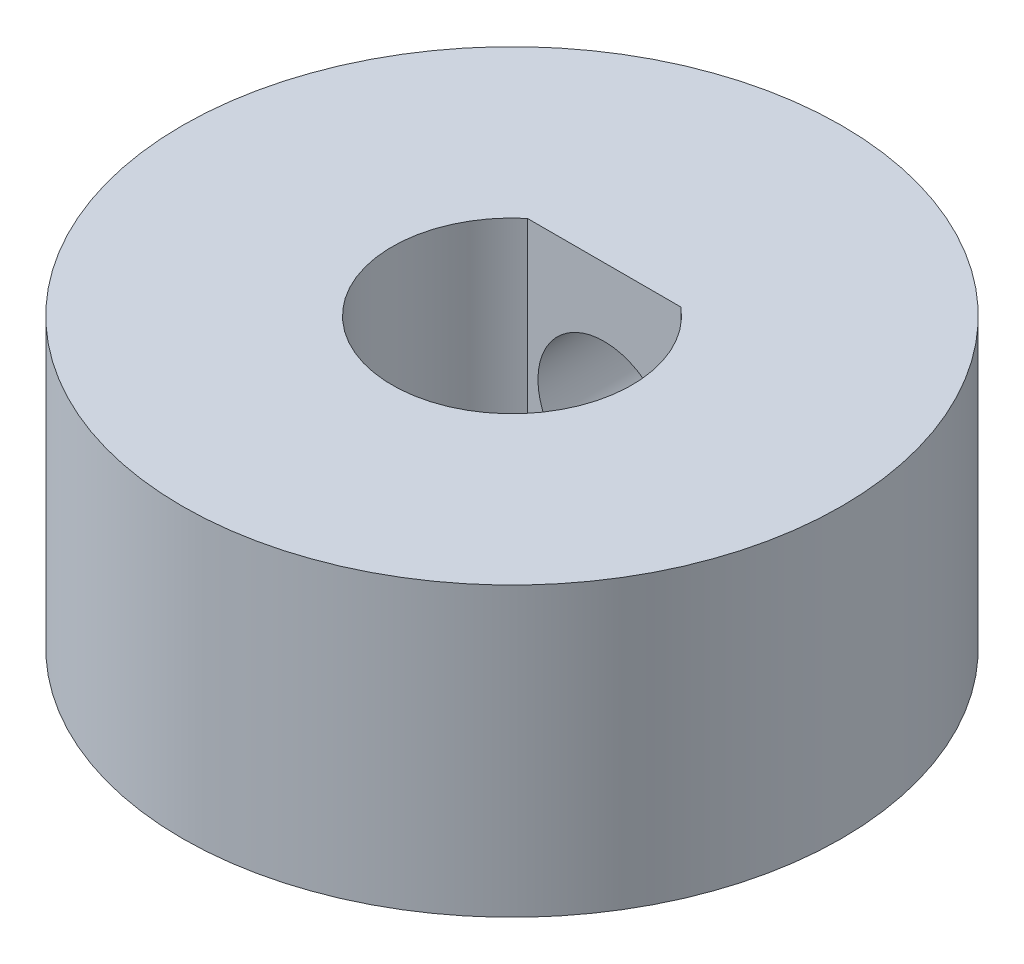
from build123d import *

# Parameters (mm, degrees)
SKETCH1_R           = 8.73125
BOSS_EXTRUDE1_DEPTH = 7.62
SKETCH2_R           = 2.7686
CUT_EXTRUDE1_DEPTH  = 3.81
CUT_EXTRUDE2_REACH  = 19.908
SKETCH3_R           = 1.7526


with BuildPart() as part:
    # Sketch1 → Boss-Extrude1 (new body)
    with BuildSketch(Plane(origin=(0, 0, 0), x_dir=(1, 0, 0), z_dir=(0, 1, 0))):
        with Locations(Location((0, 0, 0), (0, 0, 90))):
            Circle(SKETCH1_R)
        with BuildLine():
            Line((-2.032, 2.439590334), (2.032, 2.439590334))
            ThreePointArc((2.032, 2.439590334), (0, -3.175), (-2.032, 2.439590334))
        make_face(mode=Mode.SUBTRACT)
    extrude(amount=BOSS_EXTRUDE1_DEPTH)

    # Sketch2 → Cut-Extrude1 (cut)
    with BuildSketch(Plane(origin=(0, 0, -8.73125), x_dir=(-1, 0, 0), z_dir=(0, 0, -1))):
        with Locations((0, 4.064)):
            Circle(SKETCH2_R)
    extrude(amount=-CUT_EXTRUDE1_DEPTH, mode=Mode.SUBTRACT)

    # Sketch3 → Cut-Extrude2 (cut, up to next)
    with BuildSketch(Plane(origin=(0, 0, -4.92125), x_dir=(-1, 0, 0), z_dir=(0, 0, -1)), mode=Mode.PRIVATE) as cut_extrude2_sk1:
        with Locations((0, 4.064)):
            Circle(SKETCH3_R)
    cut_extrude2_tool1 = extrude(cut_extrude2_sk1.sketch, amount=-CUT_EXTRUDE2_REACH, mode=Mode.PRIVATE) & part.part
    add(cut_extrude2_tool1.solids().sort_by_distance((0, 4.064, -4.92125))[0], mode=Mode.SUBTRACT)


solid = part.part
